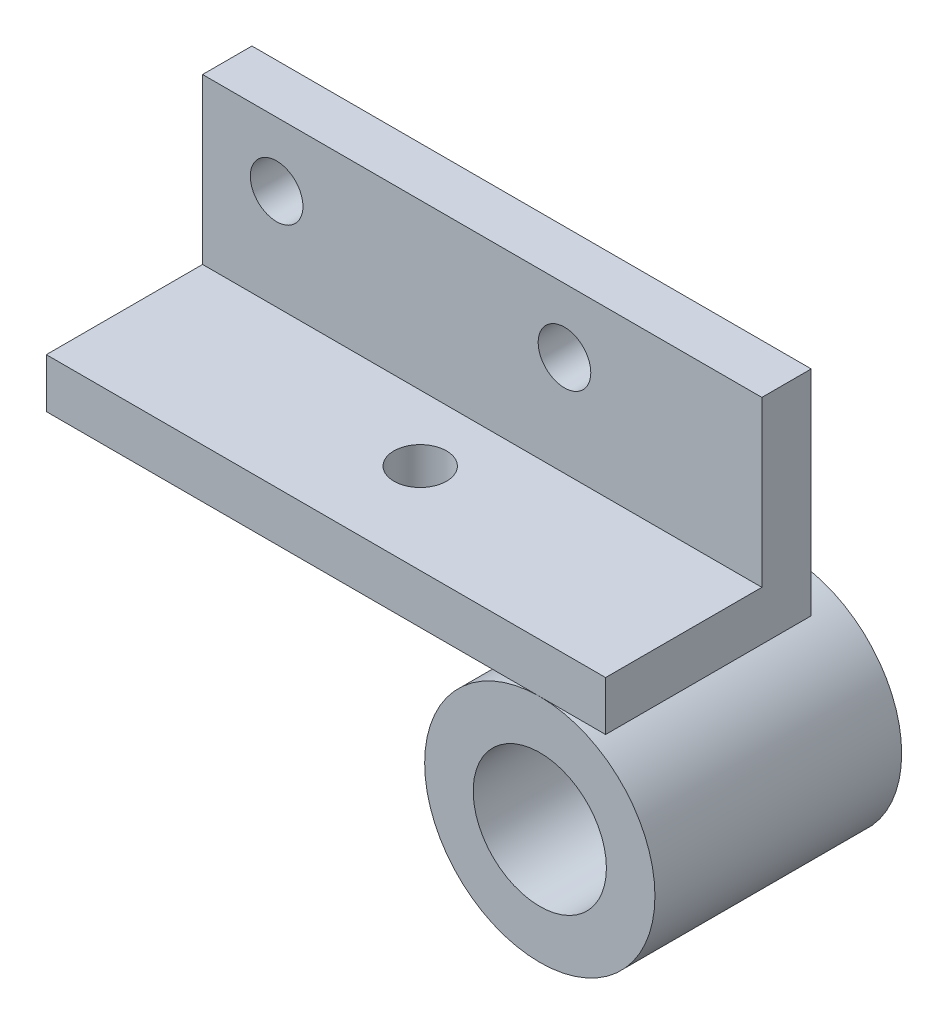
from build123d import *

# Parameters (mm, degrees)
CROQUIS1_W              = 34
CROQUIS1_H              = 9.5
SALIENTE_EXTRUIR1_DEPTH = 3
CROQUIS2_W              = 34
CROQUIS2_H              = 3
SALIENTE_EXTRUIR2_DEPTH = 13
CROQUIS3_R              = 1.6
CORTAR_EXTRUIR1_DEPTH   = 3
CROQUIS4_R              = 1.6
CORTAR_EXTRUIR2_DEPTH   = 3
CROQUIS5_R              = 7
SALIENTE_EXTRUIR3_DEPTH = 15
CROQUIS6_R              = 4.05
CORTAR_EXTRUIR3_DEPTH   = 43.308391603


with BuildPart() as part:
    # Croquis1 → Saliente-Extruir1 (new body)
    with BuildSketch(Plane(origin=(0, 0, 0), x_dir=(1, 0, 0), z_dir=(0, 1, 0))):
        with Locations((17, 4.75)):
            Rectangle(CROQUIS1_W, CROQUIS1_H)
    extrude(amount=SALIENTE_EXTRUIR1_DEPTH)

    # Croquis2 → Saliente-Extruir2 (add)
    with BuildSketch(Plane.XZ):
        with Locations((17, -11)):
            Rectangle(CROQUIS2_W, CROQUIS2_H)
    extrude(amount=-SALIENTE_EXTRUIR2_DEPTH)

    # Croquis3 → Cortar-Extruir1 (cut)
    with BuildSketch(Plane(origin=(0, 0, -12.5), x_dir=(-1, 0, 0), z_dir=(0, 0, -1))):
        with Locations((-4.5, 9.1)):
            Circle(CROQUIS3_R)
        with Locations((-22, 9.1)):
            Circle(CROQUIS3_R)
    extrude(amount=-CORTAR_EXTRUIR1_DEPTH, mode=Mode.SUBTRACT)

    # Croquis4 → Cortar-Extruir2 (cut)
    with BuildSketch(Plane.XZ):
        with Locations(Location((17.23, -5.5, 0), (0, 0, 270))):
            Circle(CROQUIS4_R)
    extrude(amount=-CORTAR_EXTRUIR2_DEPTH, mode=Mode.SUBTRACT)


with BuildPart() as body_2:
    # Croquis5 → Saliente-Extruir3 (new body)
    with BuildSketch(Plane.XY):
        with Locations((30, -7)):
            Circle(CROQUIS5_R)
    extrude(amount=-SALIENTE_EXTRUIR3_DEPTH)

    # Croquis6 → Cortar-Extruir3 (cut, through all)
    with BuildSketch(Plane.XY):
        with Locations((30, -7)):
            Circle(CROQUIS6_R)
    extrude(amount=-CORTAR_EXTRUIR3_DEPTH, mode=Mode.SUBTRACT)


solid = Compound([part.part, body_2.part])
